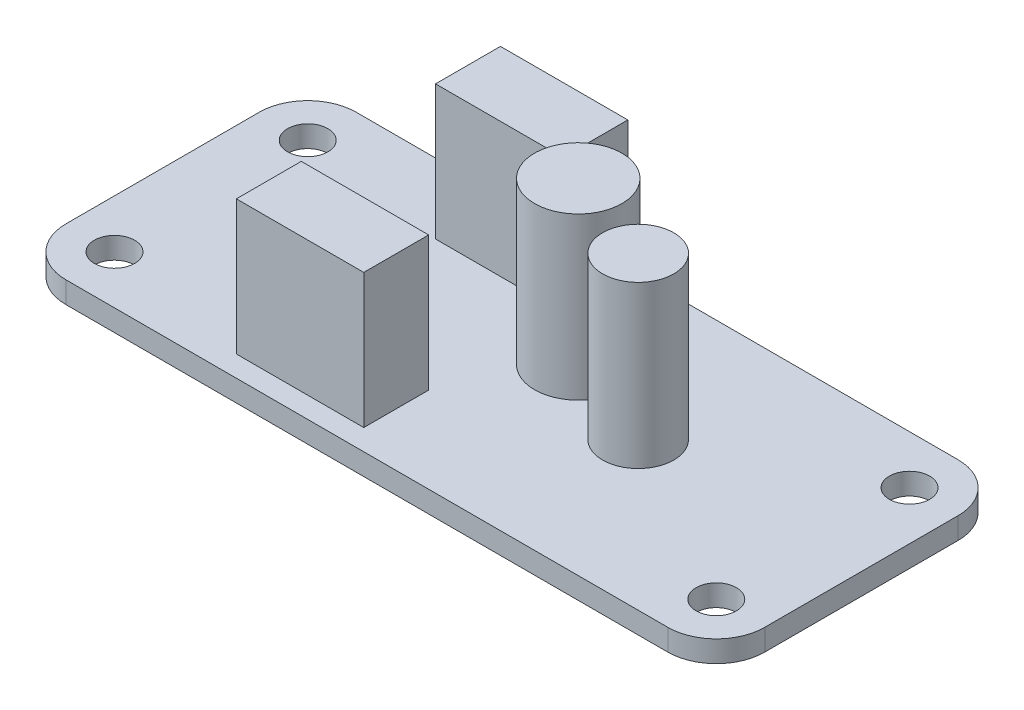
from build123d import *

# Parameters (mm, degrees)
SKETCH1_R           = 1.5
BOSS_EXTRUDE1_DEPTH = 1.6
SKETCH2_W           = 9.48
SKETCH2_H           = 4.83
BOSS_EXTRUDE2_DEPTH = 10
SKETCH3_R           = 2.65
SKETCH3_R_2         = 3.25
BOSS_EXTRUDE3_DEPTH = 12


with BuildPart() as part:
    # Sketch1 → Boss-Extrude1 (new body)
    with BuildSketch(Plane(origin=(0, 0, 0), x_dir=(1, 0, 0), z_dir=(0, 1, 0))):
        with BuildLine():
            Line((3.61, 0), (48.39, 0))
            ThreePointArc((48.39, 0), (50.94265548, 1.05734452), (52, 3.61))
            Line((52, 3.61), (52, 17.99))
            ThreePointArc((52, 17.99), (50.94265548, 20.54265548), (48.39, 21.6))
            Line((48.39, 21.6), (3.61, 21.6))
            ThreePointArc((3.61, 21.6), (1.05734452, 20.54265548), (0, 17.99))
            Line((0, 17.99), (0, 3.61))
            ThreePointArc((0, 3.61), (1.05734452, 1.05734452), (3.61, 0))
        make_face()
        with Locations(Location((3.61, 17.99, 0), (0, 0, 270))):
            Circle(SKETCH1_R, mode=Mode.SUBTRACT)
        with Locations(Location((48.39, 17.99, 0), (0, 0, 270))):
            Circle(SKETCH1_R, mode=Mode.SUBTRACT)
        with Locations(Location((48.39, 3.61, 0), (0, 0, 270))):
            Circle(SKETCH1_R, mode=Mode.SUBTRACT)
        with Locations(Location((3.61, 3.61, 0), (0, 0, 270))):
            Circle(SKETCH1_R, mode=Mode.SUBTRACT)
    extrude(amount=BOSS_EXTRUDE1_DEPTH)

    # Sketch2 → Boss-Extrude2 (add)
    with BuildSketch(Plane(origin=(0, 1.6, 0), x_dir=(1, 0, 0), z_dir=(0, 1, 0))):
        with Locations((19.47, 3.975)):
            Rectangle(SKETCH2_W, SKETCH2_H)
        with Locations((19.47, 18.795)):
            Rectangle(SKETCH2_W, SKETCH2_H)
    extrude(amount=BOSS_EXTRUDE2_DEPTH)

    # Sketch3 → Boss-Extrude3 (add)
    with BuildSketch(Plane(origin=(0, 1.6, 0), x_dir=(1, 0, 0), z_dir=(0, 1, 0))):
        with Locations(Location((35.19, 11, 0), (0, 0, 270))):
            Circle(SKETCH3_R)
        with Locations(Location((28.13, 13.6, 0), (0, 0, 270))):
            Circle(SKETCH3_R_2)
    extrude(amount=BOSS_EXTRUDE3_DEPTH)


solid = part.part
